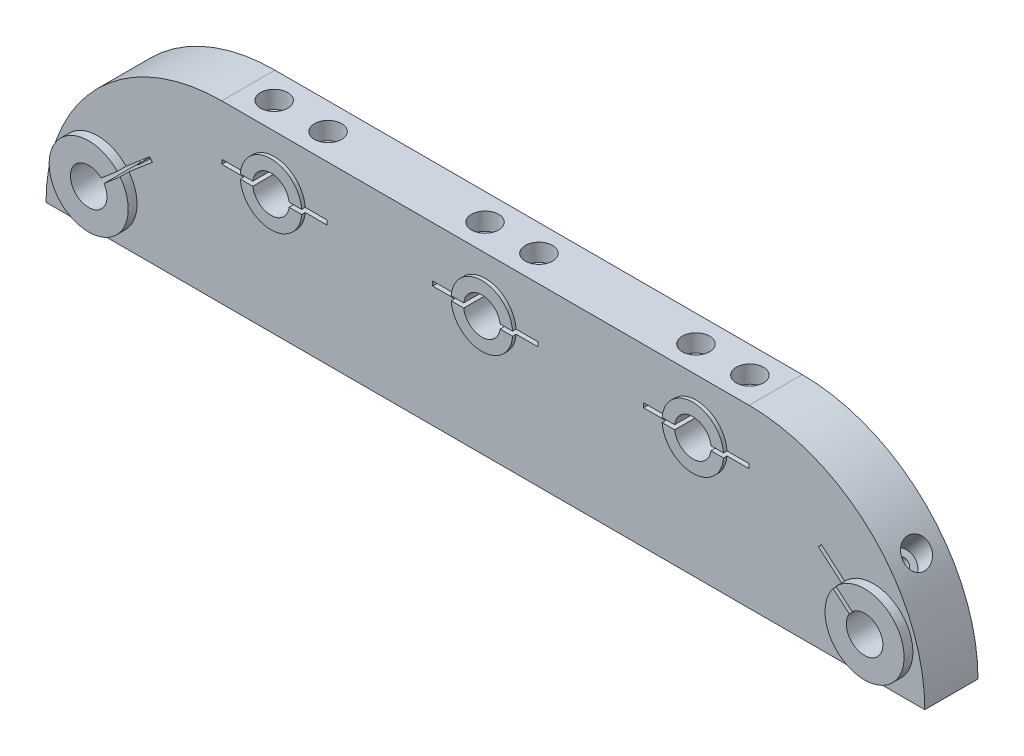
from build123d import *

# Parameters (mm, degrees)
SKETCH1_R                      = 4.165
BOSS_EXTRUDE1_DEPTH            = 12.1
SKETCH2_R                      = 7
SKETCH2_R_2                    = 4.165
BOSS_EXTRUDE3_DEPTH            = 0.8
SKETCH4_R                      = 9
SKETCH4_R_2                    = 4.165
BOSS_EXTRUDE4_DEPTH            = 2
CUT_EXTRUDE2_DEPTH             = 103.950522097
CUT_EXTRUDE2_DEPTH_BACK        = 103.950522097
CUT_EXTRUDE3_DEPTH             = 105.666422505
CUT_EXTRUDE3_DEPTH_BACK        = 105.666422505
SKETCH8_R                      = 1.6
CUT_EXTRUDE4_REACH             = 146.593
SKETCH9_R                      = 1.6
CUT_EXTRUDE4_DIRECTION_2_REACH = 146.593
CUT_EXTRUDE5_REACH             = 146.593
SKETCH10_R                     = 1.6
CUT_EXTRUDE5_DIRECTION_2_REACH = 146.593
SKETCH11_R                     = 3.1
CUT_EXTRUDE6_DEPTH             = 4
SKETCH12_R                     = 3.6
CUT_EXTRUDE7_DEPTH             = 20
CUT_EXTRUDE8_REACH             = 153.791
CUT_EXTRUDE8_END_RADIUS        = 40
SKETCH13_R                     = 3.1
CUT_EXTRUDE9_REACH             = 140.366
SKETCH14_R                     = 3.6
CUT_EXTRUDE10_REACH            = 140.366
SKETCH15_R                     = 3.6
CUT_EXTRUDE11_REACH            = 153.791
CUT_EXTRUDE11_END_RADIUS       = 40
SKETCH16_R                     = 3.1


with BuildPart() as part:
    # Sketch1 → Boss-Extrude1 (new body)
    with BuildSketch(Plane.XY):
        with BuildLine():
            Line((-60, 20), (60, 20))
            ThreePointArc((60, 20), (88.284271247, 8.284271247), (100, -20))
            Line((100, -20), (-100, -20))
            ThreePointArc((-100, -20), (-88.284271247, 8.284271247), (-60, 20))
        make_face()
        with Locations((0, 8)):
            Circle(SKETCH1_R, mode=Mode.SUBTRACT)
        with Locations((48, 8)):
            Circle(SKETCH1_R, mode=Mode.SUBTRACT)
        with Locations((-48, 8)):
            Circle(SKETCH1_R, mode=Mode.SUBTRACT)
        with Locations((-88.284271247, -10)):
            Circle(SKETCH1_R, mode=Mode.SUBTRACT)
        with Locations((88.284271247, -10)):
            Circle(SKETCH1_R, mode=Mode.SUBTRACT)
    extrude(amount=BOSS_EXTRUDE1_DEPTH)

    # Sketch2 → Boss-Extrude3 (add)
    # profile 1 of 3: a face of its own
    with BuildSketch(Plane.XY.offset(12.1)):
        with Locations(Location((-48, 8, 0), (0, 0, 180))):
            Circle(SKETCH2_R)
        with Locations((-48, 8)):
            Circle(SKETCH2_R_2, mode=Mode.SUBTRACT)
    # profile 2 of 3: a face of its own
    with BuildSketch(Plane.XY.offset(12.1)):
        with Locations(Location((0, 8, 0), (0, 0, 180))):
            Circle(SKETCH2_R)
        with Locations((0, 8)):
            Circle(SKETCH2_R_2, mode=Mode.SUBTRACT)
    # profile 3 of 3: a face of its own
    with BuildSketch(Plane.XY.offset(12.1)):
        with Locations(Location((48, 8, 0), (0, 0, 180))):
            Circle(SKETCH2_R)
        with Locations((48, 8)):
            Circle(SKETCH2_R_2, mode=Mode.SUBTRACT)
    extrude(amount=BOSS_EXTRUDE3_DEPTH)

    # Sketch4 → Boss-Extrude4 (add)
    # profile 1 of 2: a face of its own
    with BuildSketch(Plane.XY.offset(12.1)):
        with Locations(Location((-88.284271247, -10, 0), (0, 0, 180))):
            Circle(SKETCH4_R)
        with Locations((-88.284271247, -10)):
            Circle(SKETCH4_R_2, mode=Mode.SUBTRACT)
    # profile 2 of 2: a face of its own
    with BuildSketch(Plane.XY.offset(12.1)):
        with Locations(Location((88.284271247, -10, 0), (0, 0, 180))):
            Circle(SKETCH4_R)
        with Locations((88.284271247, -10)):
            Circle(SKETCH4_R_2, mode=Mode.SUBTRACT)
    extrude(amount=BOSS_EXTRUDE4_DEPTH)

    # Sketch6 → Cut-Extrude2 (cut, two sides: drawn at the far end of the back side and taken through both)
    with BuildSketch(Plane(origin=(0, 0, 0), x_dir=(-1, 0, 0), z_dir=(0, 0, -1)).offset(-CUT_EXTRUDE2_DEPTH_BACK)):
        with BuildLine():
            ThreePointArc((84.814657652, -7.695871857), (85.116355618, -7.296014873), (85.463873769, -6.935267864))
            Line((85.463873769, -6.935267864), (76.439215423, 0.767759866))
            Line((76.439215423, 0.767759866), (75.789999307, 0.007155873))
            Line((75.789999307, 0.007155873), (84.814657652, -7.695871857))
        make_face()
        with BuildLine():
            ThreePointArc((-85.463873769, -6.935267864), (-85.116355618, -7.296014873), (-84.814657652, -7.695871857))
            Line((-84.814657652, -7.695871857), (-75.789999307, 0.007155873))
            Line((-75.789999307, 0.007155873), (-76.439215423, 0.767759866))
            Line((-76.439215423, 0.767759866), (-85.463873769, -6.935267864))
        make_face()
        with BuildLine():
            Line((-52.134879079, 8.5), (-60, 8.5))
            Line((-60, 8.5), (-60, 7.5))
            Line((-60, 7.5), (-52.134879079, 7.5))
            ThreePointArc((-52.134879079, 7.5), (-52.165, 8), (-52.134879079, 8.5))
        make_face()
        with BuildLine():
            Line((-36, 8.5), (-43.865120921, 8.5))
            ThreePointArc((-43.865120921, 8.5), (-43.835, 8), (-43.865120921, 7.5))
            Line((-43.865120921, 7.5), (-36, 7.5))
            Line((-36, 7.5), (-36, 8.5))
        make_face()
        with BuildLine():
            Line((-4.134879079, 8.5), (-12, 8.5))
            Line((-12, 8.5), (-12, 7.5))
            Line((-12, 7.5), (-4.134879079, 7.5))
            ThreePointArc((-4.134879079, 7.5), (-4.165, 8), (-4.134879079, 8.5))
        make_face()
        with BuildLine():
            Line((12, 8.5), (4.134879079, 8.5))
            ThreePointArc((4.134879079, 8.5), (4.165, 8), (4.134879079, 7.5))
            Line((4.134879079, 7.5), (12, 7.5))
            Line((12, 7.5), (12, 8.5))
        make_face()
        with BuildLine():
            Line((43.865120921, 8.5), (36, 8.5))
            Line((36, 8.5), (36, 7.5))
            Line((36, 7.5), (43.865120921, 7.5))
            ThreePointArc((43.865120921, 7.5), (43.835, 8), (43.865120921, 8.5))
        make_face()
        with BuildLine():
            Line((60, 8.5), (52.134879079, 8.5))
            ThreePointArc((52.134879079, 8.5), (52.165, 8), (52.134879079, 7.5))
            Line((52.134879079, 7.5), (60, 7.5))
            Line((60, 7.5), (60, 8.5))
        make_face()
    extrude(amount=CUT_EXTRUDE2_DEPTH + CUT_EXTRUDE2_DEPTH_BACK, mode=Mode.SUBTRACT)

    # Sketch8 → Cut-Extrude3 (cut, two sides: drawn at the far end of the back side and taken through both)
    with BuildSketch(Plane(origin=(0, 7.5, 0), x_dir=(1, 0, 0), z_dir=(0, 1, 0)).offset(-CUT_EXTRUDE3_DEPTH_BACK)):
        with Locations(Location((54.134879079, -6.05, 0), (0, 0, 270))):
            Circle(SKETCH8_R)
        with Locations(Location((41.865120921, -6.05, 0), (0, 0, 270))):
            Circle(SKETCH8_R)
        with Locations(Location((6.134879079, -6.05, 0), (0, 0, 270))):
            Circle(SKETCH8_R)
        with Locations(Location((-41.865120921, -6.05, 0), (0, 0, 90))):
            Circle(SKETCH8_R)
        with Locations(Location((-6.134879079, -6.05, 0), (0, 0, 90))):
            Circle(SKETCH8_R)
        with Locations(Location((-54.134879079, -6.05, 0), (0, 0, 90))):
            Circle(SKETCH8_R)
    extrude(amount=CUT_EXTRUDE3_DEPTH + CUT_EXTRUDE3_DEPTH_BACK, mode=Mode.SUBTRACT)

    # Sketch9 → Cut-Extrude4 (cut, up to next)
    with BuildSketch(Plane(origin=(31.947621166, 37.428966387, 0), x_dir=(0.76060399265734, -0.6492161168314546, 0), z_dir=(0.6492161168314546, 0.76060399265734, 0)), mode=Mode.PRIVATE) as cut_extrude4_sk1:
        with Locations(Location((67.506651289, -6.05, 0), (0, 0, 180))):
            Circle(SKETCH9_R)
    cut_extrude4_tool1 = extrude(cut_extrude4_sk1.sketch, amount=-CUT_EXTRUDE4_REACH, mode=Mode.PRIVATE) & part.part
    add(cut_extrude4_tool1.solids().sort_by_distance((83.29345, -6.39744, 6.05))[0], mode=Mode.SUBTRACT)

    # Sketch9 → Cut-Extrude4 direction 2 (cut, up to next)
    with BuildSketch(Plane(origin=(31.947621166, 37.428966387, 0), x_dir=(0.76060399265734, -0.6492161168314546, 0), z_dir=(0.6492161168314546, 0.76060399265734, 0)), mode=Mode.PRIVATE) as cut_extrude4_direction_2_sk1:
        with Locations(Location((67.506651289, -6.05, 0), (0, 0, 180))):
            Circle(SKETCH9_R)
    cut_extrude4_direction_2_tool1 = extrude(cut_extrude4_direction_2_sk1.sketch, amount=CUT_EXTRUDE4_DIRECTION_2_REACH, mode=Mode.PRIVATE) & part.part
    add(cut_extrude4_direction_2_tool1.solids().sort_by_distance((83.29345, -6.39744, 6.05))[0], mode=Mode.SUBTRACT)

    # Sketch10 → Cut-Extrude5 (cut, up to next)
    with BuildSketch(Plane(origin=(-31.947621166, 37.428966387, 0), x_dir=(0.7606039926573399, 0.6492161168314549, 0), z_dir=(-0.6492161168314549, 0.7606039926573399, 0)), mode=Mode.PRIVATE) as cut_extrude5_sk1:
        with Locations((-67.506651289, -6.05)):
            Circle(SKETCH10_R)
    cut_extrude5_tool1 = extrude(cut_extrude5_sk1.sketch, amount=-CUT_EXTRUDE5_REACH, mode=Mode.PRIVATE) & part.part
    add(cut_extrude5_tool1.solids().sort_by_distance((-83.29345, -6.39744, 6.05))[0], mode=Mode.SUBTRACT)

    # Sketch10 → Cut-Extrude5 direction 2 (cut, up to next)
    with BuildSketch(Plane(origin=(-31.947621166, 37.428966387, 0), x_dir=(0.7606039926573399, 0.6492161168314549, 0), z_dir=(-0.6492161168314549, 0.7606039926573399, 0)), mode=Mode.PRIVATE) as cut_extrude5_direction_2_sk1:
        with Locations((-67.506651289, -6.05)):
            Circle(SKETCH10_R)
    cut_extrude5_direction_2_tool1 = extrude(cut_extrude5_direction_2_sk1.sketch, amount=CUT_EXTRUDE5_DIRECTION_2_REACH, mode=Mode.PRIVATE) & part.part
    add(cut_extrude5_direction_2_tool1.solids().sort_by_distance((-83.29345, -6.39744, 6.05))[0], mode=Mode.SUBTRACT)

    # Sketch11 → Cut-Extrude6 (cut)
    with BuildSketch(Plane(origin=(0, 20, 0), x_dir=(1, 0, 0), z_dir=(0, 1, 0))):
        with Locations(Location((-54.134879079, -6.05, 0), (0, 0, 270))):
            Circle(SKETCH11_R)
        with Locations(Location((-41.865120921, -6.05, 0), (0, 0, 270))):
            Circle(SKETCH11_R)
        with Locations(Location((-6.134879079, -6.05, 0), (0, 0, 270))):
            Circle(SKETCH11_R)
        with Locations(Location((6.134879079, -6.05, 0), (0, 0, 270))):
            Circle(SKETCH11_R)
        with Locations(Location((41.865120921, -6.05, 0), (0, 0, 270))):
            Circle(SKETCH11_R)
        with Locations(Location((54.134879079, -6.05, 0), (0, 0, 270))):
            Circle(SKETCH11_R)
    extrude(amount=-CUT_EXTRUDE6_DEPTH, mode=Mode.SUBTRACT)

    # Sketch12 → Cut-Extrude7 (cut)
    with BuildSketch(Plane.XZ.offset(20)):
        with Locations(Location((-54.134879079, 6.05, 0), (0, 0, 270))):
            Circle(SKETCH12_R)
        with Locations(Location((-41.865120921, 6.05, 0), (0, 0, 270))):
            Circle(SKETCH12_R)
        with Locations(Location((-6.134879079, 6.05, 0), (0, 0, 270))):
            Circle(SKETCH12_R)
        with Locations(Location((6.134879079, 6.05, 0), (0, 0, 270))):
            Circle(SKETCH12_R)
        with Locations(Location((41.865120921, 6.05, 0), (0, 0, 270))):
            Circle(SKETCH12_R)
        with Locations(Location((54.134879079, 6.05, 0), (0, 0, 270))):
            Circle(SKETCH12_R)
    extrude(amount=-CUT_EXTRUDE7_DEPTH, mode=Mode.SUBTRACT)

    # Cut-Extrude8: up to this cylinder (the profile starts inside it)
    cut_extrude8_end = Plane(origin=(-60, -20, 6.05), z_dir=(0, 0, -1)) * Cylinder(CUT_EXTRUDE8_END_RADIUS, 388.582, mode=Mode.PRIVATE)
    # Sketch13 → Cut-Extrude8 (cut, up to the surface)
    with BuildSketch(Plane(origin=(-37.1413501, 43.513798328, 0), x_dir=(-0.76060399265734, -0.6492161168314547, 0), z_dir=(0.6492161168314547, -0.76060399265734, 0)), mode=Mode.PRIVATE) as cut_extrude8_sk1:
        with Locations(Location((67.506651289, -6.05, 0), (0, 0, 180))):
            Circle(SKETCH13_R)
    cut_extrude8_tool1 = extrude(cut_extrude8_sk1.sketch, amount=-CUT_EXTRUDE8_REACH, mode=Mode.PRIVATE) & cut_extrude8_end
    add(cut_extrude8_tool1.solids().sort_by_distance((-88.487179, -0.312608, 6.05))[0], mode=Mode.SUBTRACT)

    # Cut-Extrude9: up to this plane
    cut_extrude9_end = Plane(origin=(-100, -20, 12.1), z_dir=(0, 1, 0))
    # Sketch14 → Cut-Extrude9 (cut, up to the surface)
    with BuildSketch(Plane(origin=(-27.403108348, 32.104738438, 0), x_dir=(0.76060399265734, 0.6492161168314547, 0), z_dir=(-0.6492161168314547, 0.76060399265734, 0)), mode=Mode.PRIVATE) as cut_extrude9_sk1:
        with Locations(Location((-67.506651289, -6.05, 0), (0, 0, 180))):
            Circle(SKETCH14_R)
    cut_extrude9_tool1 = split(extrude(cut_extrude9_sk1.sketch, amount=-CUT_EXTRUDE9_REACH, mode=Mode.PRIVATE), bisect_by=cut_extrude9_end, keep=Keep.BOTH, mode=Mode.PRIVATE)
    add(cut_extrude9_tool1.solids().sort_by_distance((-78.748937, -11.721668, 6.05))[0], mode=Mode.SUBTRACT)

    # Cut-Extrude10: up to this plane
    cut_extrude10_end = Plane(origin=(-100, -20, 12.1), z_dir=(0, 1, 0))
    # Sketch15 → Cut-Extrude10 (cut, up to the surface)
    with BuildSketch(Plane(origin=(27.403108348, 32.104738438, 0), x_dir=(0.76060399265734, -0.6492161168314547, 0), z_dir=(0.6492161168314547, 0.76060399265734, 0)), mode=Mode.PRIVATE) as cut_extrude10_sk1:
        with Locations(Location((67.506651289, -6.05, 0), (0, 0, 180))):
            Circle(SKETCH15_R)
    cut_extrude10_tool1 = split(extrude(cut_extrude10_sk1.sketch, amount=-CUT_EXTRUDE10_REACH, mode=Mode.PRIVATE), bisect_by=cut_extrude10_end, keep=Keep.BOTH, mode=Mode.PRIVATE)
    add(cut_extrude10_tool1.solids().sort_by_distance((78.748937, -11.721668, 6.05))[0], mode=Mode.SUBTRACT)

    # Cut-Extrude11: up to this cylinder (the profile starts inside it)
    cut_extrude11_end = Plane(origin=(60, -20, 6.05), z_dir=(0, 0, -1)) * Cylinder(CUT_EXTRUDE11_END_RADIUS, 388.582, mode=Mode.PRIVATE)
    # Sketch16 → Cut-Extrude11 (cut, up to the surface)
    with BuildSketch(Plane(origin=(37.1413501, 43.513798328, 0), x_dir=(-0.7606039926573408, 0.6492161168314537, 0), z_dir=(-0.6492161168314537, -0.7606039926573408, 0)), mode=Mode.PRIVATE) as cut_extrude11_sk1:
        with Locations(Location((-67.506651289, -6.05, 0), (0, 0, 180))):
            Circle(SKETCH16_R)
    cut_extrude11_tool1 = extrude(cut_extrude11_sk1.sketch, amount=-CUT_EXTRUDE11_REACH, mode=Mode.PRIVATE) & cut_extrude11_end
    add(cut_extrude11_tool1.solids().sort_by_distance((88.487179, -0.312608, 6.05))[0], mode=Mode.SUBTRACT)


solid = part.part
